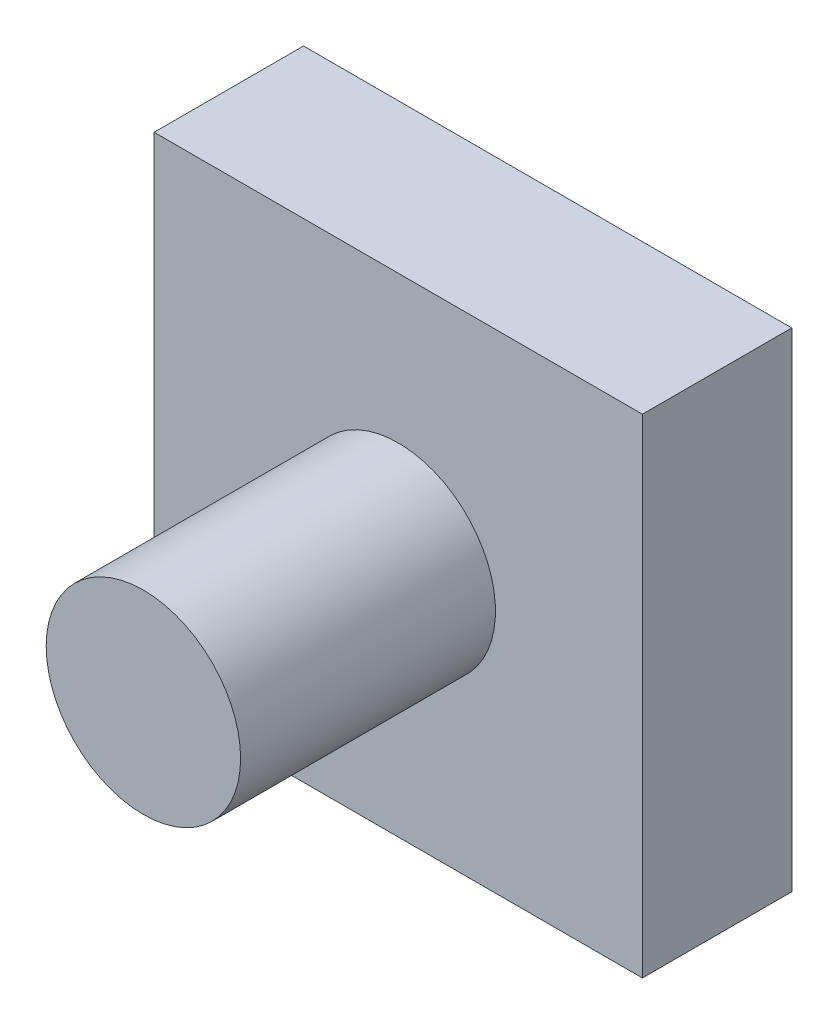
from build123d import *

# Parameters (mm, degrees)
SKETCH1_W      = 35.2806
SKETCH1_H      = 35.2806
EXTRUDE1_DEPTH = 10.795
SKETCH2_R      = 7.0231
EXTRUDE2_DEPTH = 18.415


with BuildPart() as part:
    # Sketch1 → Extrude1 (new body)
    with BuildSketch(Plane.XY):
        Rectangle(SKETCH1_W, SKETCH1_H)
    extrude(amount=EXTRUDE1_DEPTH)

    # Sketch2 → Extrude2 (add)
    with BuildSketch(Plane.XY.offset(10.795)):
        with Locations(Location((0, 0, 0), (0, 0, 180))):
            Circle(SKETCH2_R)
    extrude(amount=EXTRUDE2_DEPTH)


solid = part.part
